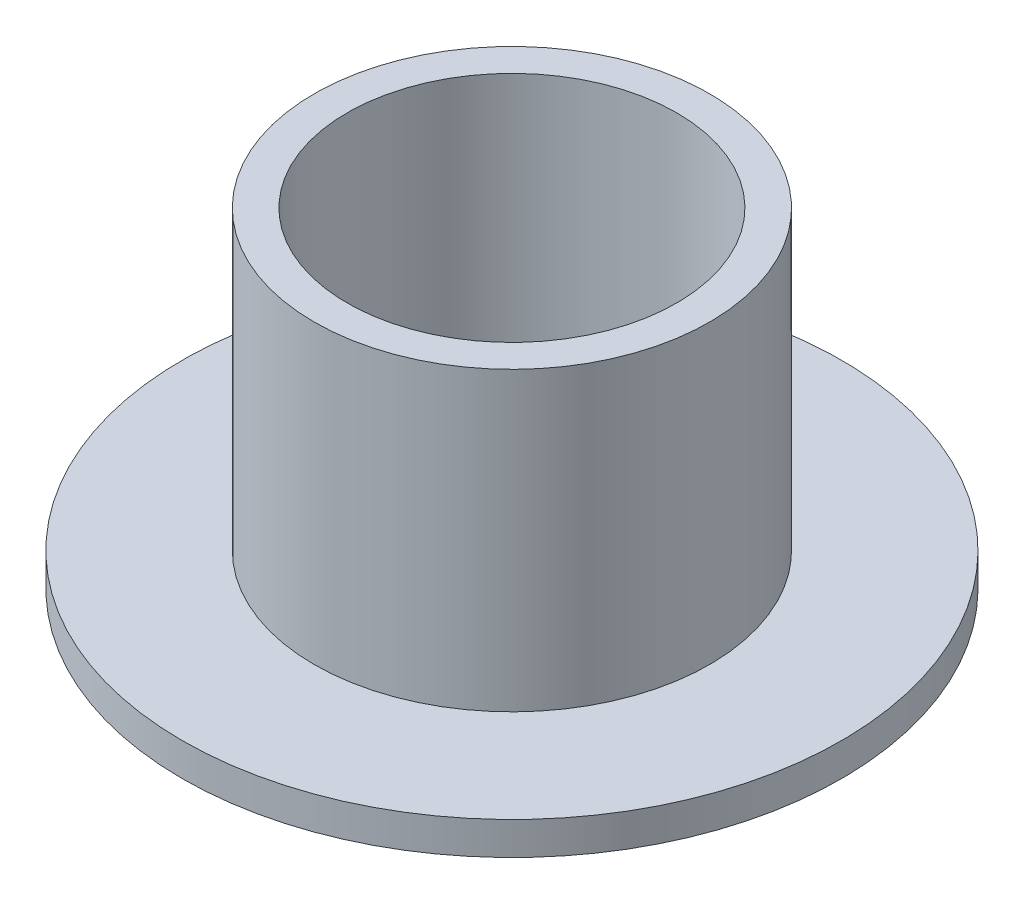
from build123d import *

# Parameters (mm, degrees)
SKETCH_1_R          = 5
EXTRUDE_1_DEPTH     = 0.5
SKETCH_2_R          = 3
EXTRUDE_2_DEPTH     = 4.5
SKETCH_3_R          = 2.5
CUT_EXTRUDE_1_DEPTH = 9.660254038


with BuildPart() as part:
    # 草图1 → 凸台-拉伸1 (new body)
    with BuildSketch(Plane(origin=(0, 0, 0), x_dir=(1, 0, 0), z_dir=(0, 1, 0))):
        Circle(SKETCH_1_R)
    extrude(amount=EXTRUDE_1_DEPTH)

    # 草图2 → 凸台-拉伸2 (add)
    with BuildSketch(Plane(origin=(0, 0.5, 0), x_dir=(1, 0, 0), z_dir=(0, 1, 0))):
        Circle(SKETCH_2_R)
    extrude(amount=EXTRUDE_2_DEPTH)

    # 草图3 → 切除-拉伸1 (cut, through all)
    with BuildSketch(Plane.XZ):
        Circle(SKETCH_3_R)
    extrude(amount=-CUT_EXTRUDE_1_DEPTH, mode=Mode.SUBTRACT)


solid = part.part
